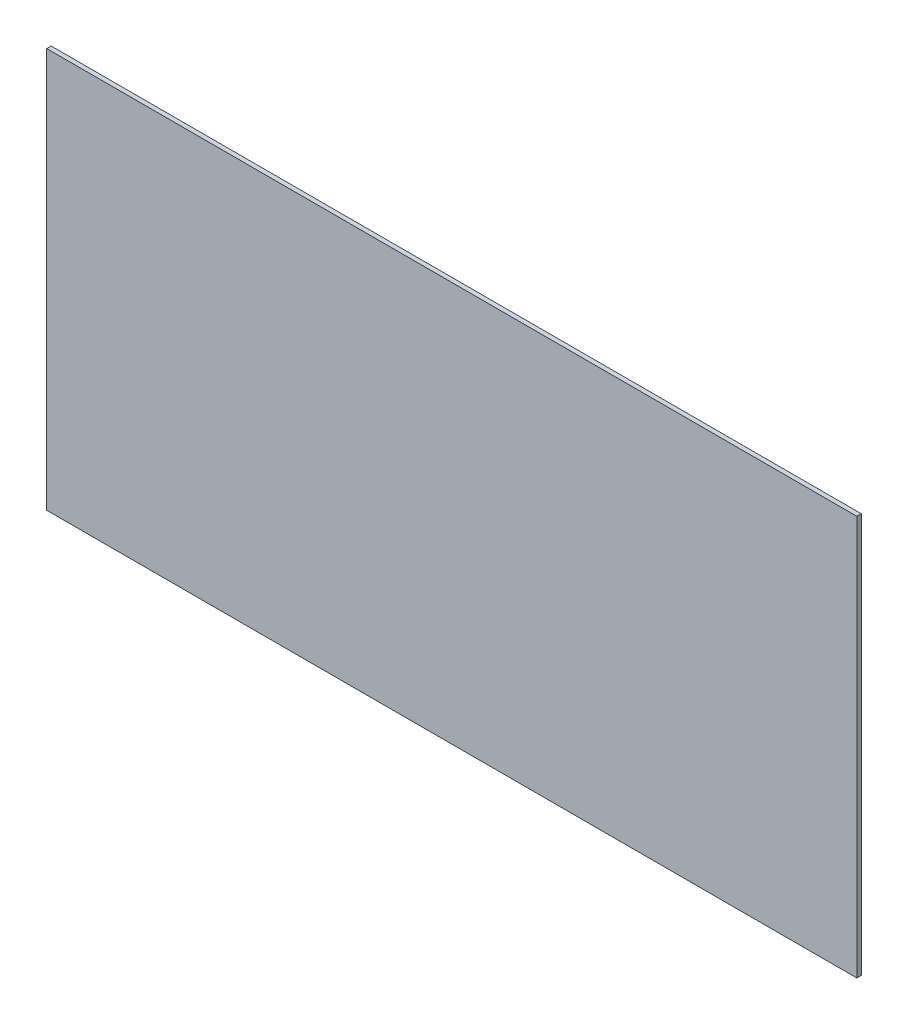
from build123d import *

# Parameters (mm, degrees)
SKETCH1_W           = 547
SKETCH1_H           = 270
BOSS_EXTRUDE1_DEPTH = 3


with BuildPart() as part:
    # Sketch1 → Boss-Extrude1 (new body)
    with BuildSketch(Plane.XY):
        Rectangle(SKETCH1_W, SKETCH1_H)
    extrude(amount=BOSS_EXTRUDE1_DEPTH)


solid = part.part
